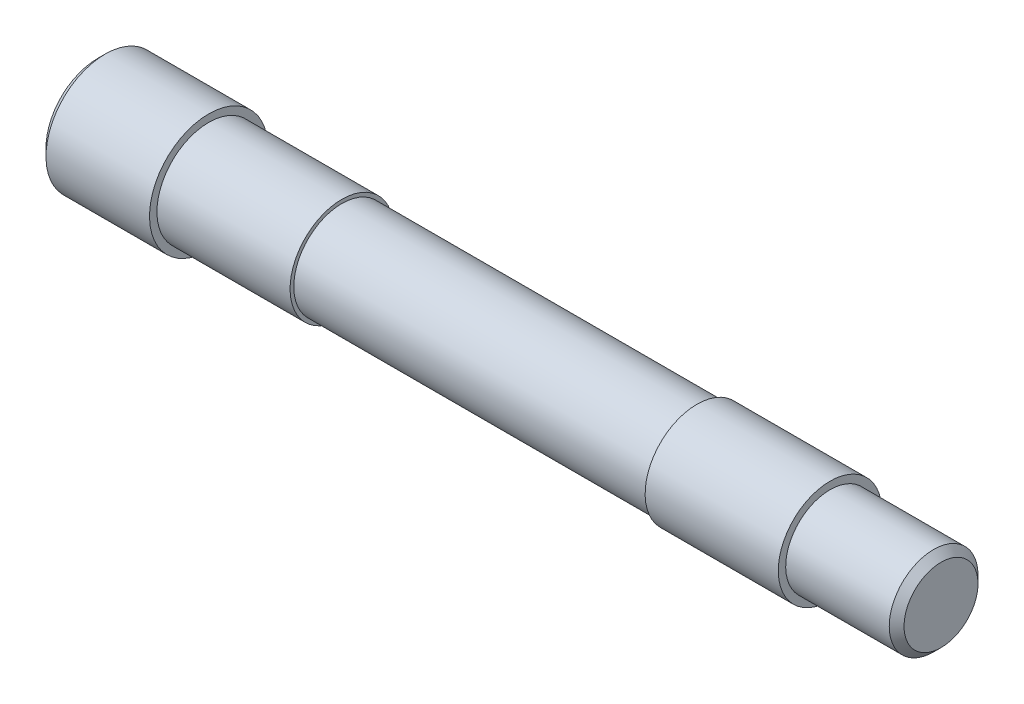
from build123d import *

# Parameters (mm, degrees)
SKETCH2_W     = 38.1
SKETCH2_H     = 10.31875
SKETCH2_W_2   = 23.8125
SKETCH2_H_2   = 9.525
CHAMFER4_SIZE = 1.5875
CHAMFER5_SIZE = 1.5875
SKETCH3_W     = 4.7625
SKETCH3_H     = 4.7625


with BuildPart() as part:
    # Sketch2 → Revolve1 (revolve)
    with BuildSketch(Plane.XY):
        Polygon((-90.4875, 12.7), (-90.4875, 0), (-66.675, 0), (-66.675, 11.1125), (-66.675, 12.7), align=None)
        Polygon((-66.675, 11.1125), (-66.675, 0), (-38.1, 0), (-38.1, 10.31875), (-38.1, 11.1125), align=None)
        with Locations((-19.05, 5.159375)):
            Rectangle(SKETCH2_W, SKETCH2_H)
        with Locations((19.05, 5.159375)):
            Rectangle(SKETCH2_W, SKETCH2_H)
        Polygon((38.1, 10.31875), (38.1, 0), (66.675, 0), (66.675, 9.525), (66.675, 11.1125), (38.1, 11.1125), align=None)
        with Locations((78.58125, 4.7625)):
            Rectangle(SKETCH2_W_2, SKETCH2_H_2)
    revolve(axis=Axis((90.4875, 0, 0), (-1, 0, 0)))

    # Chamfer4
    chamfer4_edges = [part.edges().sort_by_distance(p)[0] for p in [
        (90.4875, -9.525, 0),
    ]]
    chamfer(chamfer4_edges, length=CHAMFER4_SIZE)

    # Chamfer5
    chamfer5_edges = [part.edges().sort_by_distance(p)[0] for p in [
        (-90.4875, -12.7, 0),
    ]]
    chamfer(chamfer5_edges, length=CHAMFER5_SIZE)

    # Sketch3 → Cut-Revolve1 (revolve, cut)
    with BuildSketch(Plane.XY, mode=Mode.PRIVATE) as cut_revolve1_sk:
        with Locations((-54.76875, -8.73125)):
            Rectangle(SKETCH3_W, SKETCH3_H)
    revolve(cut_revolve1_sk.sketch.rotate(Axis((-52.3875, -1001.138899493, 0), (0, 1, 0)), 270), axis=Axis((-52.3875, -1001.138899493, 0), (0, 1, 0)), mode=Mode.SUBTRACT)


solid = part.part
